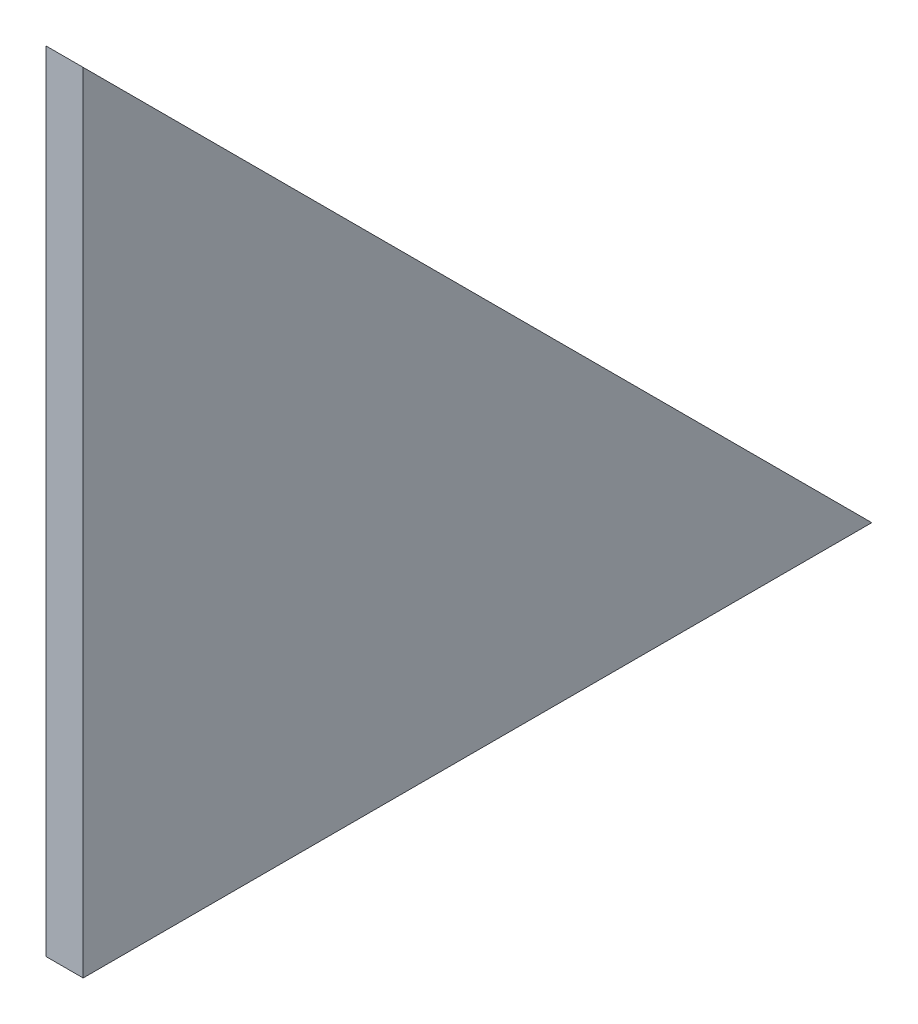
from build123d import *

# Parameters (mm, degrees)
BOSS_EXTRUDE1_DEPTH = 11.90625


with BuildPart() as part:
    # Sketch1 → Boss-Extrude1 (new body)
    with BuildSketch(Plane(origin=(0, 0, 0), x_dir=(0, 0, -1), z_dir=(1, 0, 0))):
        Polygon((0, 0), (0, 254), (254, 0), align=None)
    extrude(amount=BOSS_EXTRUDE1_DEPTH)


solid = part.part
